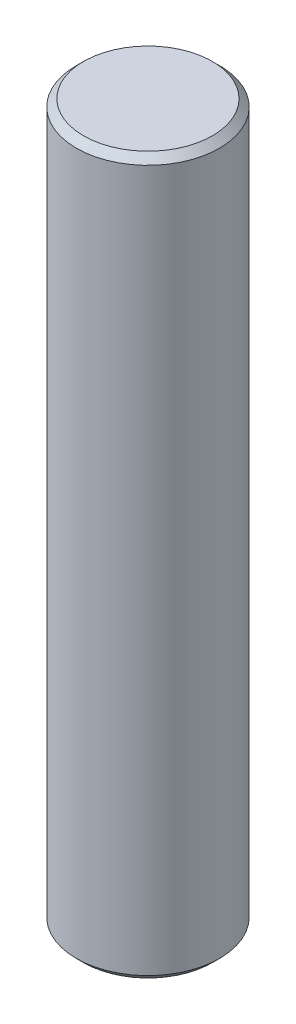
from build123d import *

# Parameters (mm, degrees)
SKETCH1_R           = 3
BOSS_EXTRUDE1_DEPTH = 30
CHAMFER1_SIZE       = 0.3


with BuildPart() as part:
    # Sketch1 → Boss-Extrude1 (new body)
    with BuildSketch(Plane(origin=(0, 0, 0), x_dir=(1, 0, 0), z_dir=(0, 1, 0))):
        with Locations(Location((0, 0, 0), (0, 0, 270))):
            Circle(SKETCH1_R)
    extrude(amount=BOSS_EXTRUDE1_DEPTH)

    # Chamfer1
    chamfer1_edges = [part.edges().sort_by_distance(p)[0] for p in [
        (0, 0, -3),
        (0, 30, -3),
    ]]
    chamfer(chamfer1_edges, length=CHAMFER1_SIZE)


solid = part.part
